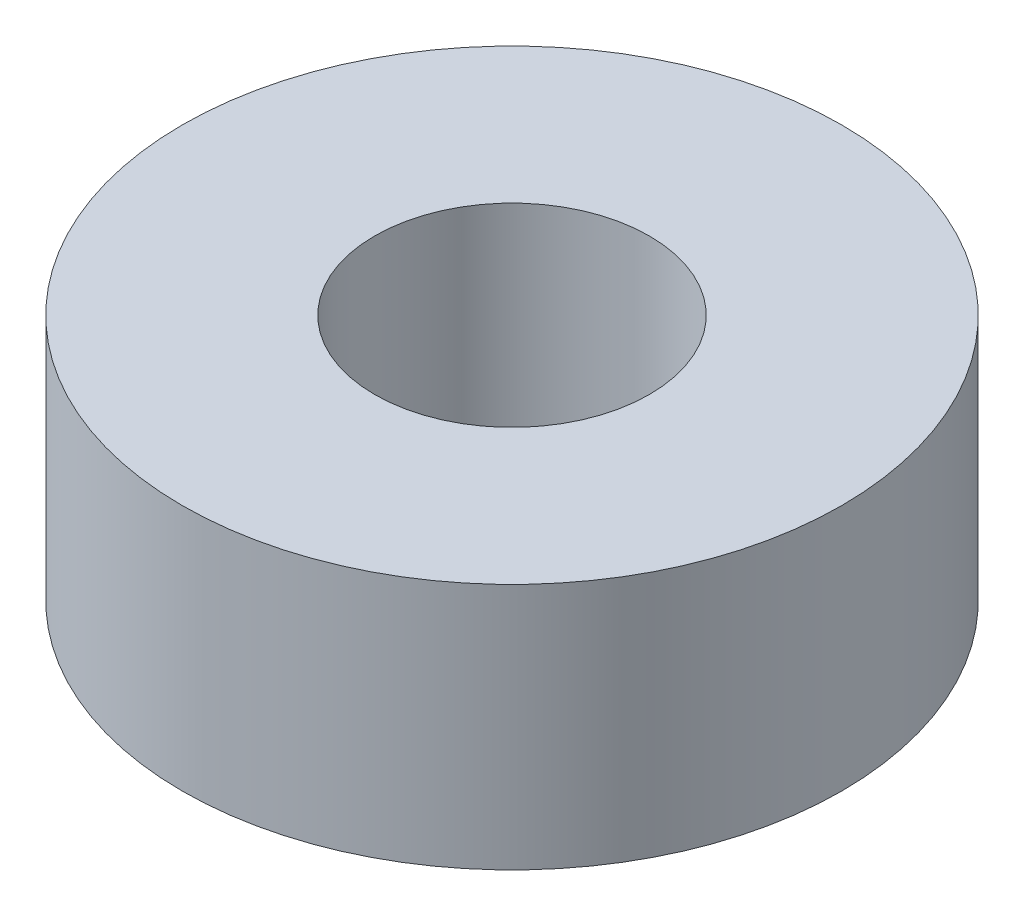
from build123d import *

# Parameters (mm, degrees)
SKETCH1_R           = 12
SKETCH1_R_2         = 5
BOSS_EXTRUDE1_DEPTH = 9


with BuildPart() as part:
    # Sketch1 → Boss-Extrude1 (new body)
    with BuildSketch(Plane(origin=(0, 0, 0), x_dir=(1, 0, 0), z_dir=(0, 1, 0))):
        with Locations(Location((0, 0, 0), (0, 0, 270))):
            Circle(SKETCH1_R)
        with Locations(Location((0, 0, 0), (0, 0, 270))):
            Circle(SKETCH1_R_2, mode=Mode.SUBTRACT)
    extrude(amount=BOSS_EXTRUDE1_DEPTH)


solid = part.part
